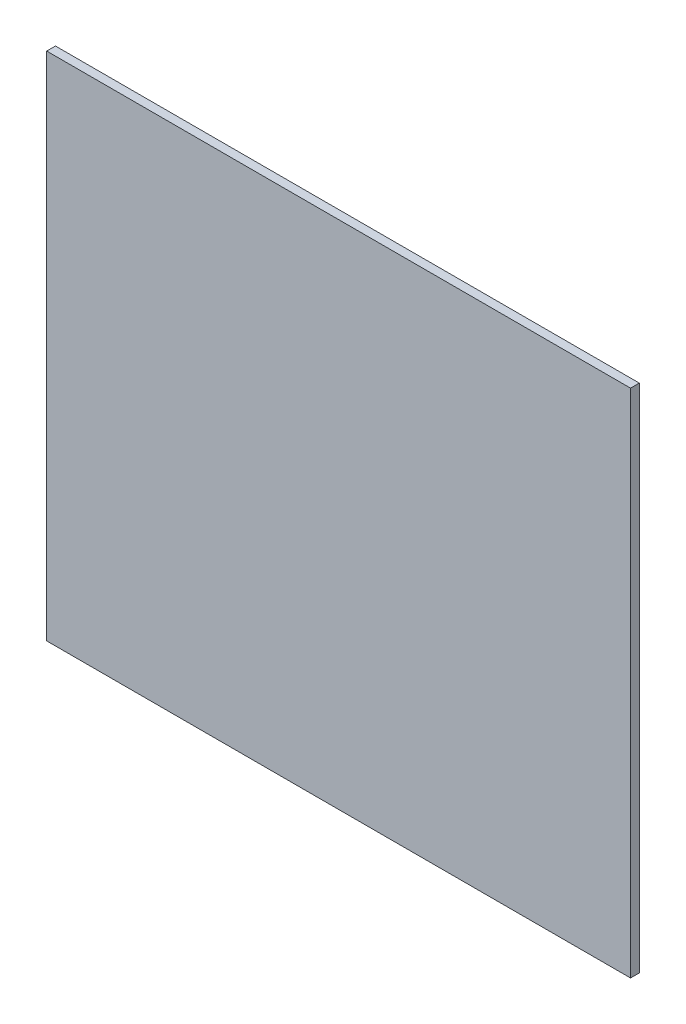
from build123d import *

# Parameters (mm, degrees)
SKETCH1_W           = 200
SKETCH1_H           = 175
BOSS_EXTRUDE1_DEPTH = 3


with BuildPart() as part:
    # Sketch1 → Boss-Extrude1 (new body)
    with BuildSketch(Plane.XY):
        Rectangle(SKETCH1_W, SKETCH1_H)
    extrude(amount=BOSS_EXTRUDE1_DEPTH)


solid = part.part
